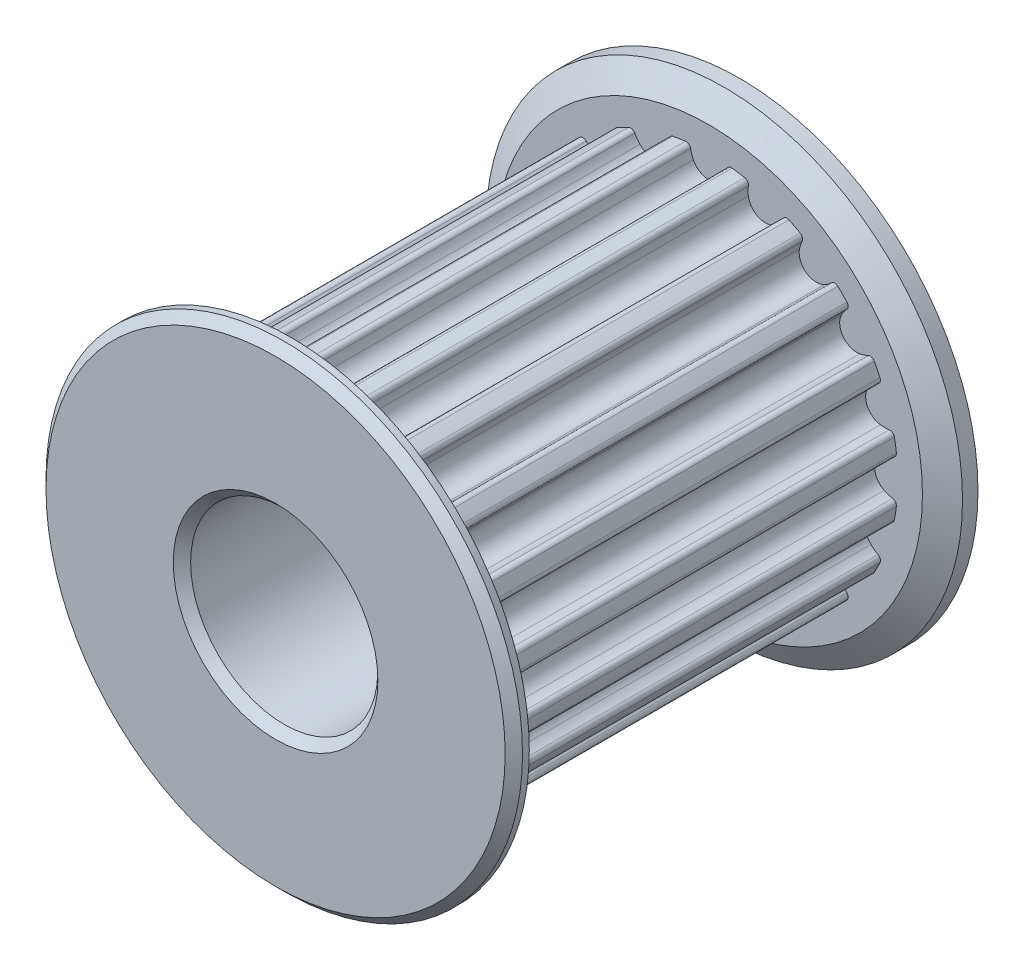
from build123d import *

# Parameters (mm, degrees)
CUT_EXTRUDE1_START  = 6.5
CUT_EXTRUDE1_DEPTH  = 13
CIRPATTERN1_COUNT   = 20
CHAMFER1_SIZE       = 0.28075
SKETCH5_W           = 3.33166625
SKETCH5_H           = 0.5
BOSS_EXTRUDE1_DEPTH = 9


with BuildPart() as part:
    # Sketch2 → Revolve1 (revolve)
    with BuildSketch(Plane(origin=(0, 0, 0), x_dir=(0, 0, -1), z_dir=(1, 0, 0)), mode=Mode.PRIVATE) as revolve1_sk:
        Polygon((-7.5, 3.025), (7.5, 3.025), (7.5, 7.6995), (7, 7.6995), (6.5, 6.904), (6.5, 6.1085), (-6.5, 6.1085), (-6.5, 6.904), (-7, 7.6995), (-7.5, 7.6995), align=None)
    revolve(revolve1_sk.sketch.rotate(Axis((0, 0, 7.5), (0, 0, -1)), 90), axis=Axis((0, 0, 7.5), (0, 0, -1)))

    # Sketch3 → Cut-Extrude1 (cut)
    with BuildSketch(Plane.XY.offset(CUT_EXTRUDE1_START)):
        with BuildLine():
            Line((2.514420398, 7.6995), (-2.514420398, 7.6995))
            Line((-2.514420398, 7.6995), (-1.896292335, 5.806707124))
            ThreePointArc((-1.896292335, 5.806707124), (-1.330166224, 5.961914966), (-0.751756185, 6.062065233))
            ThreePointArc((-0.751756185, 6.062065233), (-0.643911332, 6.033664451), (-0.58547487, 5.93867868))
            ThreePointArc((-0.58547487, 5.93867868), (-0.551683777, 5.801420225), (-0.498876404, 5.670297753))
            ThreePointArc((-0.498876404, 5.670297753), (0, 5.3585), (0.498876404, 5.670297753))
            ThreePointArc((0.498876404, 5.670297753), (0.551683777, 5.801420225), (0.58547487, 5.93867868))
            ThreePointArc((0.58547487, 5.93867868), (0.643911332, 6.033664451), (0.751756185, 6.062065233))
            ThreePointArc((0.751756185, 6.062065233), (1.330166224, 5.961914966), (1.896292335, 5.806707124))
            Line((1.896292335, 5.806707124), (2.514420398, 7.6995))
        make_face()
    cut_extrude1 = extrude(amount=-CUT_EXTRUDE1_DEPTH, mode=Mode.SUBTRACT)

    # CirPattern1: Cut-Extrude1 ×20 about axis
    cirpattern1_axis = Axis((0, 0, 0), (0, 0, 1))
    for i in range(1, CIRPATTERN1_COUNT):
        add(cut_extrude1.rotate(cirpattern1_axis, i * 360 / CIRPATTERN1_COUNT), mode=Mode.SUBTRACT)

    # Chamfer1
    chamfer1_edges = [part.edges().sort_by_distance(p)[0] for p in [
        (-3.025, 0, 7.5),
        (-7.6995, 0, 7.5),
    ]]
    chamfer(chamfer1_edges, length=CHAMFER1_SIZE)

    # Sketch5 → Boss-Extrude1 (add)
    with BuildSketch(Plane(origin=(0, 0, -7.5), x_dir=(-1, 0, 0), z_dir=(0, 0, -1))):
        with Locations((0, -2.775)):
            Rectangle(SKETCH5_W, SKETCH5_H)
    extrude(amount=-BOSS_EXTRUDE1_DEPTH)


solid = part.part
